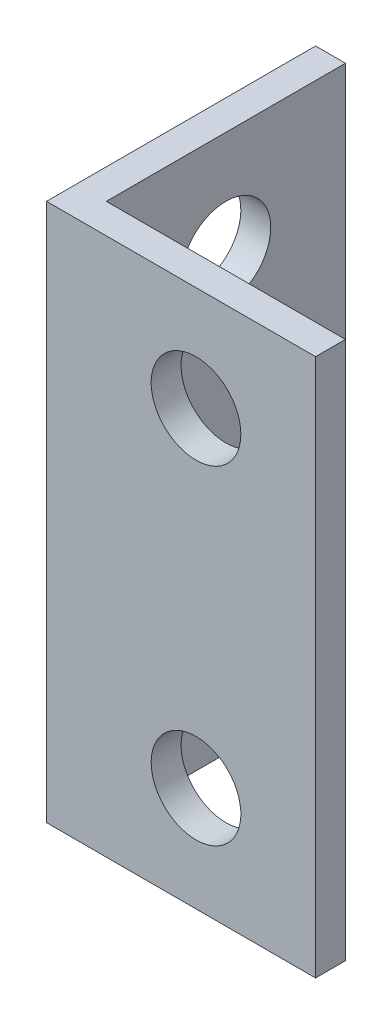
from build123d import *

# Parameters (mm, degrees)
ESQUISSE1_W             = 8
ESQUISSE1_H             = 18
BOSS_EXTRU_1_DEPTH      = 1
ESQUISSE2_W             = 1
ESQUISSE2_H             = 18
BOSS_EXTRU_2_DEPTH      = 9
ESQUISSE3_R             = 1.5
ENL_V_MAT_EXTRU_1_DEPTH = 22.260291625
ESQUISSE4_R             = 1.5
ENL_V_MAT_EXTRU_2_DEPTH = 21.322401433


with BuildPart() as part:
    # Esquisse1 → Boss.-Extru.1 (new body)
    with BuildSketch(Plane.XY):
        with Locations((0, 9)):
            Rectangle(ESQUISSE1_W, ESQUISSE1_H)
    extrude(amount=BOSS_EXTRU_1_DEPTH)

    # Esquisse2 → Boss.-Extru.2 (add)
    with BuildSketch(Plane.XY.offset(1)):
        with Locations((-4.5, 9)):
            Rectangle(ESQUISSE2_W, ESQUISSE2_H)
    extrude(amount=-BOSS_EXTRU_2_DEPTH)

    # Esquisse3 → Enlèv. mat.-Extru.1 (cut, through all)
    with BuildSketch(Plane(origin=(-4, 0, 0), x_dir=(0, 0, -1), z_dir=(1, 0, 0))):
        with Locations(Location((4, 14.5, 0), (0, 0, 90))):
            Circle(ESQUISSE3_R)
        with Locations(Location((4, 3.5, 0), (0, 0, 270))):
            Circle(ESQUISSE3_R)
    extrude(amount=-ENL_V_MAT_EXTRU_1_DEPTH, mode=Mode.SUBTRACT)

    # Esquisse4 → Enlèv. mat.-Extru.2 (cut, through all)
    with BuildSketch(Plane(origin=(0, 0, 0), x_dir=(-1, 0, 0), z_dir=(0, 0, -1))):
        with Locations((0, 3.5)):
            Circle(ESQUISSE4_R)
        with Locations(Location((0, 14.5, 0), (0, 0, 180))):
            Circle(ESQUISSE4_R)
    extrude(amount=-ENL_V_MAT_EXTRU_2_DEPTH, mode=Mode.SUBTRACT)


solid = part.part
